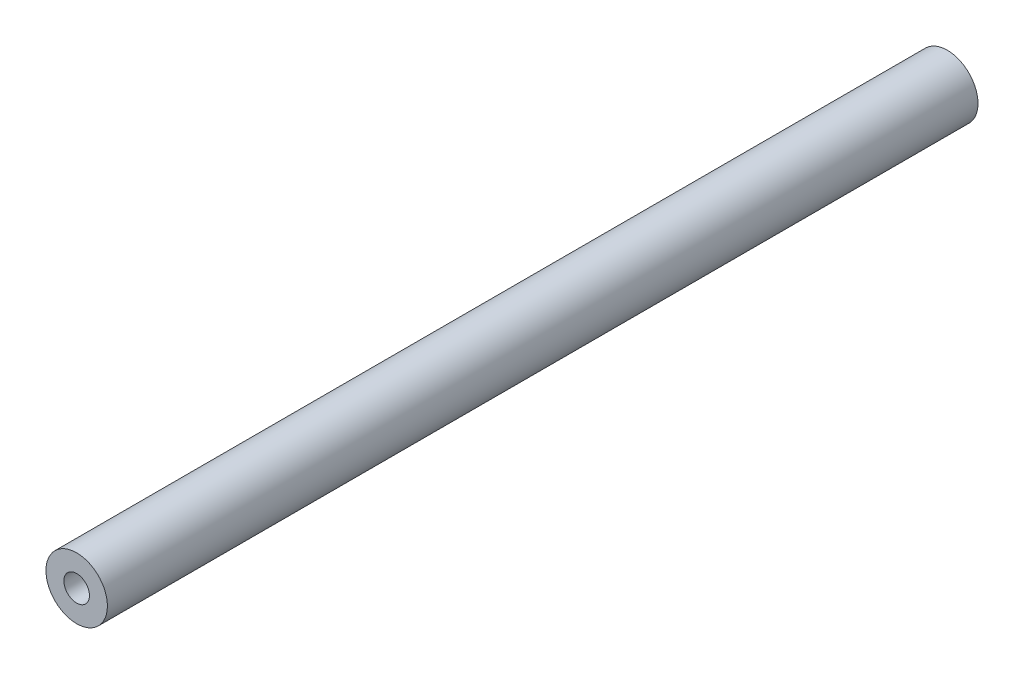
from build123d import *

# Parameters (mm, degrees)
ESBO_O1_R                                   = 3
RESSALTO_EXTRUS_O1_DEPTH                    = 85
BROCA_DE_ROSQUEAR_PARA_TARRAXA_DE_M32_D     = 2.5
BROCA_DE_ROSQUEAR_PARA_TARRAXA_DE_M32_DEPTH = 8
BROCA_DE_ROSQUEAR_PARA_TARRAXA_DE_M32_TIP   = 0.751075774


with BuildPart() as part:
    # Esboço1 → Ressalto-extrusão1 (new body)
    with BuildSketch(Plane.XY):
        Circle(ESBO_O1_R)
    extrude(amount=RESSALTO_EXTRUS_O1_DEPTH)

    # Esboço2 → Broca de rosquear para tarraxa de M31 (revolve, cut)
    with BuildSketch(Plane(origin=(0, 0, 85), x_dir=(0, -1, 0), z_dir=(1, 0, 0))):
        Polygon((0, 0), (0, 8.751075774), (1.25, 8), (1.25, 0), align=None)
    revolve(axis=Axis((0, 0, 91.35), (0, 0, -1)), mode=Mode.SUBTRACT)

    # Broca de rosquear para tarraxa de M32
    with Locations(Plane(origin=(0, 0, 0), x_dir=(-1, 0, 0), z_dir=(0, 0, -1))):
        with Locations((0, 0)):
            Hole(BROCA_DE_ROSQUEAR_PARA_TARRAXA_DE_M32_D / 2, depth=BROCA_DE_ROSQUEAR_PARA_TARRAXA_DE_M32_DEPTH)
            with Locations((0, 0, -(BROCA_DE_ROSQUEAR_PARA_TARRAXA_DE_M32_DEPTH + BROCA_DE_ROSQUEAR_PARA_TARRAXA_DE_M32_TIP / 2))):  # 118° drill point
                Cone(0, BROCA_DE_ROSQUEAR_PARA_TARRAXA_DE_M32_D / 2, BROCA_DE_ROSQUEAR_PARA_TARRAXA_DE_M32_TIP, mode=Mode.SUBTRACT)


solid = part.part
